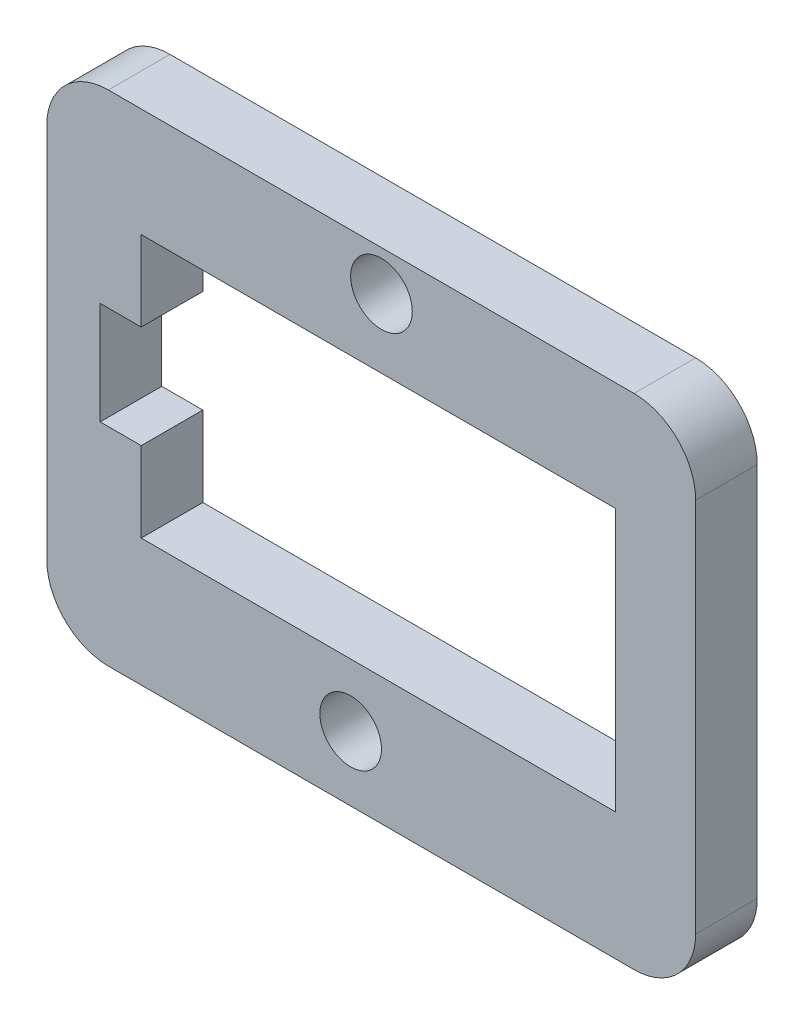
from build123d import *

# Parameters (mm, degrees)
SKETCH1_R           = 1.5
BOSS_EXTRUDE1_DEPTH = 3


with BuildPart() as part:
    # Sketch1 → Boss-Extrude1 (new body)
    with BuildSketch(Plane.XY):
        with BuildLine():
            Line((28.6, 0), (28.6, 18.3))
            ThreePointArc((28.6, 18.3), (27.721320344, 20.421320344), (25.6, 21.3))
            Line((25.6, 21.3), (0, 21.3))
            ThreePointArc((0, 21.3), (-2.121320344, 20.421320344), (-3, 18.3))
            Line((-3, 18.3), (-3, 0))
            ThreePointArc((-3, 0), (-2.121320344, -2.121320344), (0, -3))
            Line((0, -3), (25.6, -3))
            ThreePointArc((25.6, -3), (27.721320344, -2.121320344), (28.6, 0))
        make_face()
        with Locations((11.8, 0.15)):
            Circle(SKETCH1_R, mode=Mode.SUBTRACT)
        with Locations((13.3, 19.35)):
            Circle(SKETCH1_R, mode=Mode.SUBTRACT)
        Polygon((24.7, 3.2), (24.7, 16), (1.6, 16), (1.6, 12.1), (-0.4, 12.1), (-0.4, 7.1), (1.6, 7.1), (1.6, 3.2), align=None, mode=Mode.SUBTRACT)
    extrude(amount=BOSS_EXTRUDE1_DEPTH)


solid = part.part
